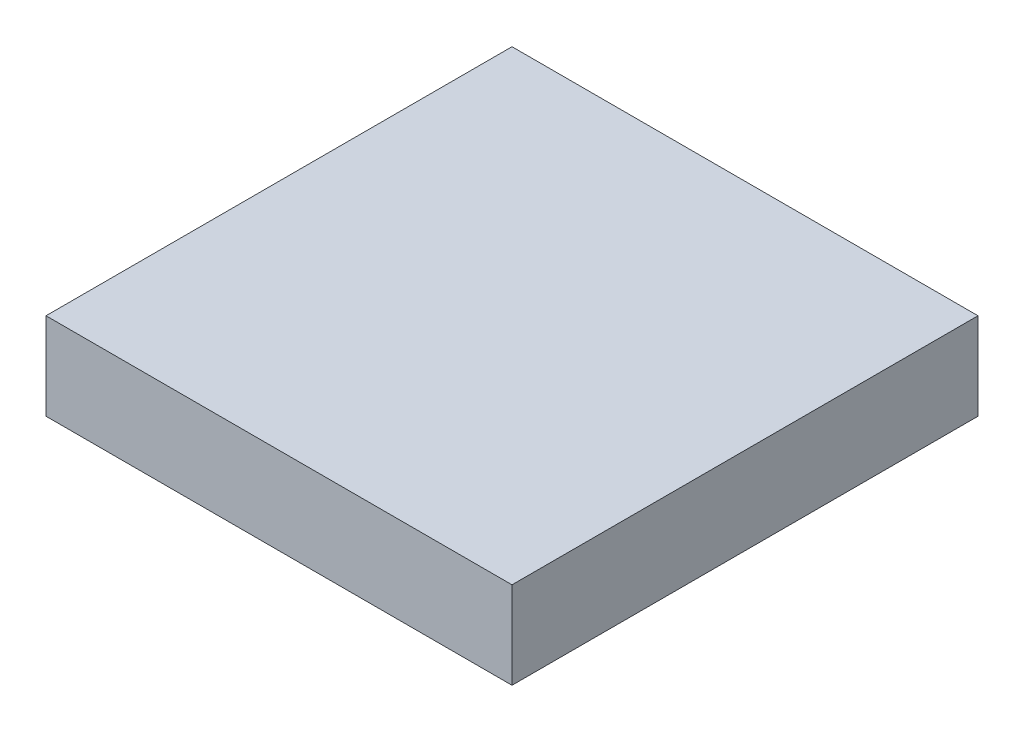
from build123d import *

# Parameters (mm, degrees)
SKETCH1_W           = 17
SKETCH1_H           = 17
BOSS_EXTRUDE1_DEPTH = 3.175


with BuildPart() as part:
    # Sketch1 → Boss-Extrude1 (new body)
    with BuildSketch(Plane(origin=(0, 0, 0), x_dir=(1, 0, 0), z_dir=(0, 1, 0))):
        Rectangle(SKETCH1_W, SKETCH1_H)
    extrude(amount=BOSS_EXTRUDE1_DEPTH)


solid = part.part
